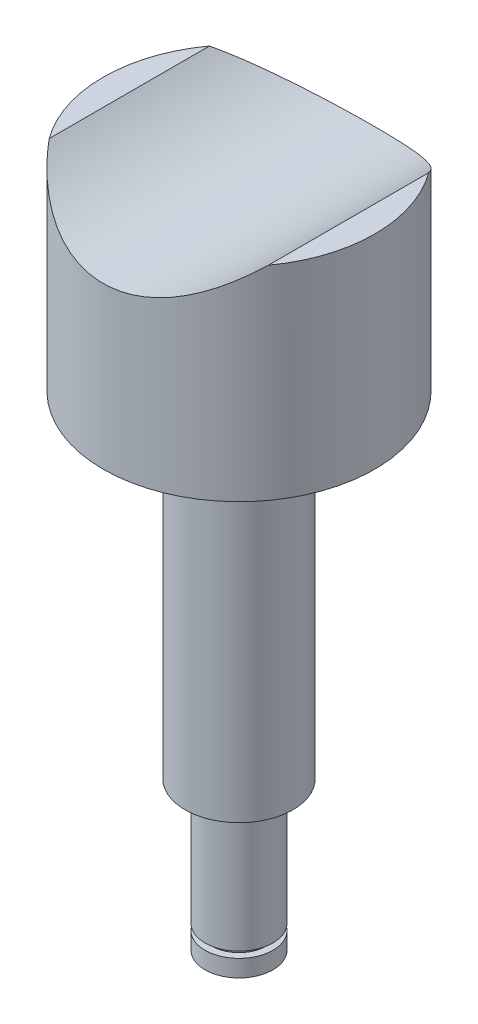
from build123d import *

# Parameters (mm, degrees)
SKETCH1_R               = 16
BOSS_EXTRUDE1_DEPTH     = 24
SKETCH2_R               = 6.35
BOSS_EXTRUDE2_DEPTH     = 39.57
SKETCH3_R               = 4
BOSS_EXTRUDE3_DEPTH     = 17.5
CUT_EXTRUDE1_DEPTH      = 62.392058933
CUT_EXTRUDE1_DEPTH_BACK = 62.392058933
SKETCH4_R               = 19.05
CUT_EXTRUDE2_START      = -2
SKETCH5_R               = 4.571040919
SKETCH5_R_2             = 3.175
CUT_EXTRUDE2_DEPTH      = 0.74


with BuildPart() as part:
    # Sketch1 → Boss-Extrude1 (new body)
    with BuildSketch(Plane(origin=(0, 0, 0), x_dir=(1, 0, 0), z_dir=(0, 1, 0))):
        with Locations(Location((0, 0, 0), (0, 0, 270))):
            Circle(SKETCH1_R)
    extrude(amount=BOSS_EXTRUDE1_DEPTH)

    # Sketch2 → Boss-Extrude2 (add)
    with BuildSketch(Plane.XZ):
        with Locations(Location((0, 0, 0), (0, 0, 270))):
            Circle(SKETCH2_R)
    extrude(amount=BOSS_EXTRUDE2_DEPTH)

    # Sketch3 → Boss-Extrude3 (add)
    with BuildSketch(Plane.XZ.offset(39.57)):
        with Locations(Location((0, 0, 0), (0, 0, 270))):
            Circle(SKETCH3_R)
    extrude(amount=BOSS_EXTRUDE3_DEPTH)

    # Sketch4 → Cut-Extrude1 (cut, two sides: drawn at the far end of the back side and taken through both)
    with BuildSketch(Plane.XY.offset(-CUT_EXTRUDE1_DEPTH_BACK)):
        with Locations((0, 38)):
            Circle(SKETCH4_R)
    extrude(amount=CUT_EXTRUDE1_DEPTH + CUT_EXTRUDE1_DEPTH_BACK, mode=Mode.SUBTRACT)

    # Sketch5 → Cut-Extrude2 (cut)
    with BuildSketch(Plane.XZ.offset(57.07).offset(CUT_EXTRUDE2_START)):
        Circle(SKETCH5_R)
        with Locations(Location((0, 0, 0), (0, 0, 270))):
            Circle(SKETCH5_R_2, mode=Mode.SUBTRACT)
    extrude(amount=-CUT_EXTRUDE2_DEPTH, mode=Mode.SUBTRACT)


solid = part.part
